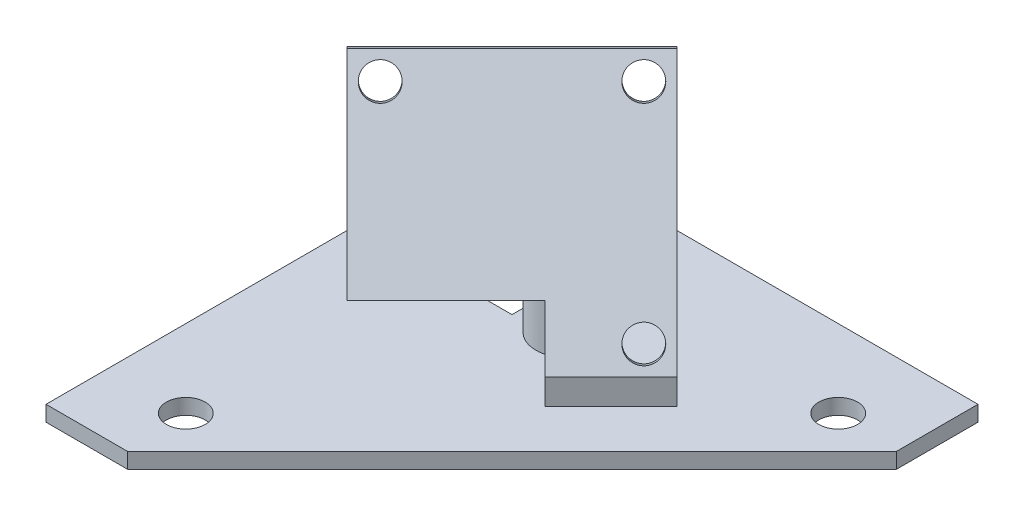
from build123d import *

# Parameters (mm, degrees)
SKETCH_1_R      = 2.5
EXTRUDE_1_DEPTH = 2
SKETCH_2_R      = 2
EXTRUDE_3_DEPTH = 2
EXTRUDE_4_REACH = 91.774
SKETCH_4_R      = 4
EXTRUDE_5_REACH = 91.774


with BuildPart() as part:
    # 草图1 → 凸台-拉伸1 (new body)
    with BuildSketch(Plane(origin=(0, 0, 0), x_dir=(1, 0, 0), z_dir=(0, 1, 0))):
        Polygon((10.502525317, -60), (60, -10.502525317), (60, 0), (20, 0), (20, -20), (0, -20), (0, -60), align=None)
        with Locations(Location((10, -52, 0), (0, 0, 270))):
            Circle(SKETCH_1_R, mode=Mode.SUBTRACT)
        with Locations(Location((52, -10, 0), (0, 0, 270))):
            Circle(SKETCH_1_R, mode=Mode.SUBTRACT)
    extrude(amount=EXTRUDE_1_DEPTH)



with BuildPart() as body_2:
    # 草图2 → 凸台-拉伸3 (new body)
    with BuildSketch(Plane(origin=(23.112372436, 18.871173071, 23.112372436), x_dir=(-0.7071067811865475, 0, 0.7071067811865477), z_dir=(0.6123724356957955, 0.4999999999999981, 0.6123724356957954))):
        Polygon((-3, 16.786030205), (-15, 16.786030205), (-15, -13.213969795), (15, -13.213969795), (15, 9.786030205), (-3, 9.786030205), align=None)
        with Locations(Location((-12, -10.213969795, 0), (0, 0, 180))):
            Circle(SKETCH_2_R, mode=Mode.SUBTRACT)
        with Locations(Location((12, -10.213969795, 0), (0, 0, 180))):
            Circle(SKETCH_2_R, mode=Mode.SUBTRACT)
        with Locations(Location((-12, 13.786030205, 0), (0, 0, 180))):
            Circle(SKETCH_2_R, mode=Mode.SUBTRACT)
    extrude(amount=EXTRUDE_3_DEPTH)


with BuildPart() as part_1:
    add(part.part)

    add(body_2.part)  # 凸台-拉伸4 merges body 2
    # 凸台-拉伸4: up to this plane
    extrude_4_end = Plane(origin=(23.112372436, 18.871173071, 23.112372436), z_dir=(0.6123724356957954, 0.4999999999999981, 0.6123724356957952))
    # 草图4 → 凸台-拉伸4 (add, up to the surface)
    with BuildSketch(Plane(origin=(0, 2, 0), x_dir=(1, 0, 0), z_dir=(0, 1, 0)), mode=Mode.PRIVATE) as extrude_4_sk1:
        with Locations(Location((25.511596423, -18.440528611, 0), (0, 0, 315))):
            Circle(SKETCH_4_R)
    extrude_4_tool1 = split(extrude(extrude_4_sk1.sketch, amount=EXTRUDE_4_REACH, mode=Mode.PRIVATE), bisect_by=extrude_4_end, keep=Keep.BOTH, mode=Mode.PRIVATE)
    add(extrude_4_tool1.solids().sort_by_distance((25.511596, 2, 18.440529))[0])

    # 草图5 → 凸台-拉伸5 (add, up to next)
    with BuildSketch(Plane(origin=(0, 2, 0), x_dir=(1, 0, 0), z_dir=(0, 1, 0)), mode=Mode.PRIVATE) as extrude_5_sk1:
        Polygon((39.653732047, -18.440528611), (31.168450673, -26.925809986), (32.393195544, -28.150554857), (40.878476918, -19.665273483), align=None)
    extrude_5_tool1 = extrude(extrude_5_sk1.sketch, amount=EXTRUDE_5_REACH, mode=Mode.PRIVATE) - part_1.part
    add(extrude_5_tool1.solids().sort_by_distance((36.023464, 2, 23.295542))[0])


solid = part_1.part
